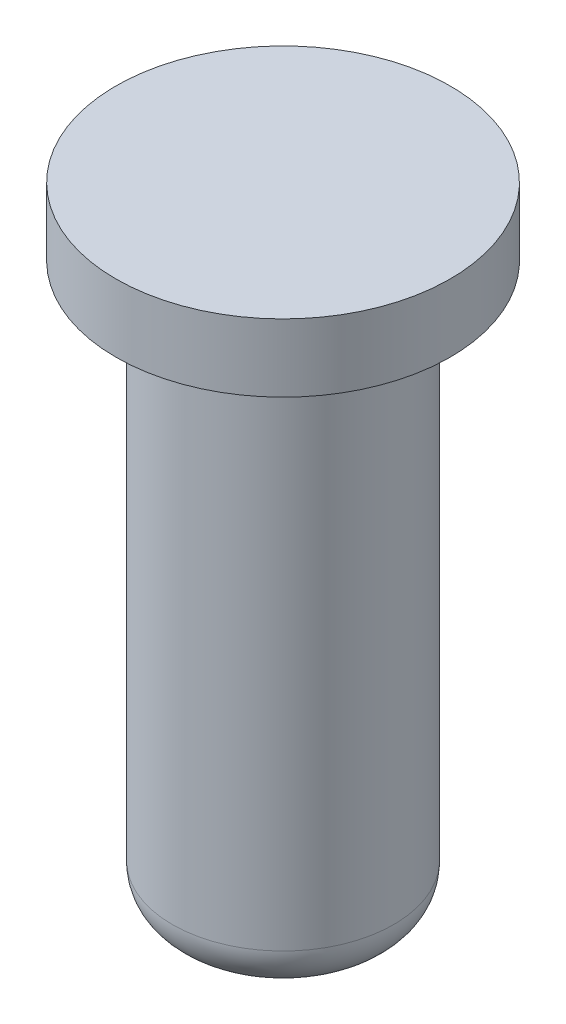
from build123d import *

# Parameters (mm, degrees)
SKETCH1_R           = 4.9
BOSS_EXTRUDE1_DEPTH = 25
SKETCH2_R           = 7.4
BOSS_EXTRUDE2_DEPTH = 3
FILLET1_R           = 2


with BuildPart() as part:
    # Sketch1 → Boss-Extrude1 (new body)
    with BuildSketch(Plane(origin=(0, 0, 0), x_dir=(1, 0, 0), z_dir=(0, 1, 0))):
        with Locations(Location((0, 0, 0), (0, 0, 270))):
            Circle(SKETCH1_R)
    extrude(amount=BOSS_EXTRUDE1_DEPTH)

    # Sketch2 → Boss-Extrude2 (add)
    with BuildSketch(Plane(origin=(0, 25, 0), x_dir=(1, 0, 0), z_dir=(0, 1, 0))):
        with Locations(Location((0, 0, 0), (0, 0, 270))):
            Circle(SKETCH2_R)
    extrude(amount=BOSS_EXTRUDE2_DEPTH)

    # Fillet1
    fillet1_edges = [part.edges().sort_by_distance(p)[0] for p in [
        (0, 0, -4.9),
    ]]
    fillet(fillet1_edges, radius=FILLET1_R)


solid = part.part
